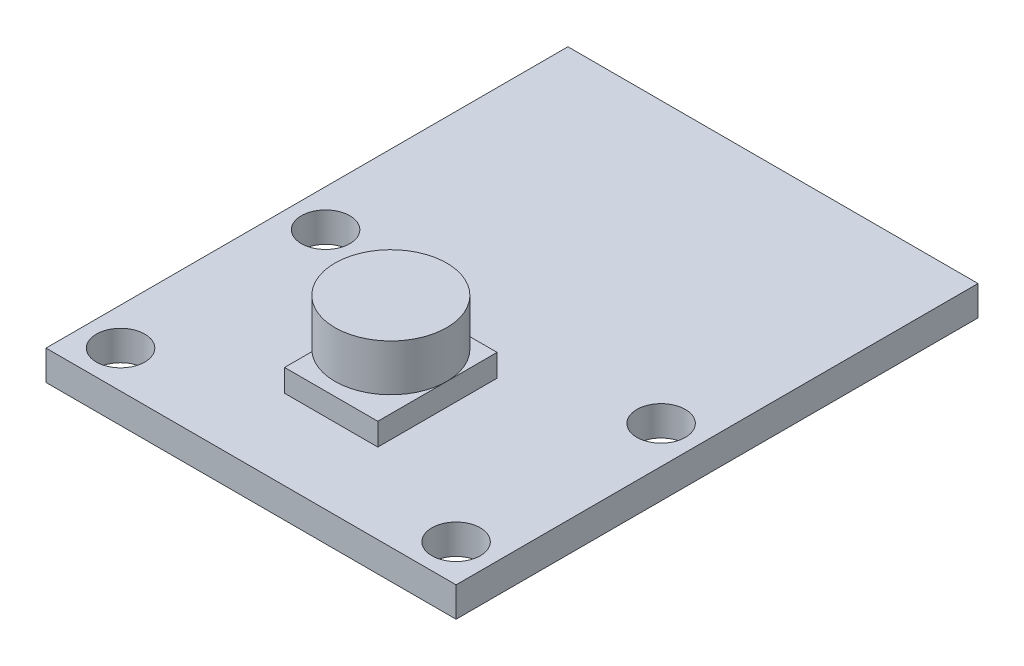
from build123d import *

# Parameters (mm, degrees)
ESQUISSE1_W        = 22
ESQUISSE1_H        = 28
ESQUISSE1_R        = 1.3
BOSS_EXTRU_1_DEPTH = 1.6
ESQUISSE2_W        = 5
ESQUISSE2_H        = 6.4
BOSS_EXTRU_2_DEPTH = 1.2
BOSS_EXTRU_3_START = 0.5
ESQUISSE3_R        = 3
BOSS_EXTRU_3_DEPTH = 2.5


with BuildPart() as part:
    # Esquisse1 → Boss.-Extru.1 (new body)
    with BuildSketch(Plane(origin=(0, 0, 0), x_dir=(1, 0, 0), z_dir=(0, 1, 0))):
        with Locations((0, 6.5)):
            Rectangle(ESQUISSE1_W, ESQUISSE1_H)
        with Locations(Location((-9, 5.5, 0), (0, 0, 270))):
            Circle(ESQUISSE1_R, mode=Mode.SUBTRACT)
        with Locations(Location((9, 5.5, 0), (0, 0, 270))):
            Circle(ESQUISSE1_R, mode=Mode.SUBTRACT)
        with Locations(Location((9, -5.5, 0), (0, 0, 270))):
            Circle(ESQUISSE1_R, mode=Mode.SUBTRACT)
        with Locations(Location((-9, -5.5, 0), (0, 0, 270))):
            Circle(ESQUISSE1_R, mode=Mode.SUBTRACT)
    extrude(amount=BOSS_EXTRU_1_DEPTH)

    # Esquisse2 → Boss.-Extru.2 (add)
    with BuildSketch(Plane(origin=(0, 1.6, 0), x_dir=(1, 0, 0), z_dir=(0, 1, 0))):
        Rectangle(ESQUISSE2_W, ESQUISSE2_H)
    extrude(amount=BOSS_EXTRU_2_DEPTH)


with BuildPart() as body_2:
    # Esquisse3 → Boss.-Extru.3 (new body)
    with BuildSketch(Plane(origin=(0, 2.8, 0), x_dir=(1, 0, 0), z_dir=(0, 1, 0)).offset(BOSS_EXTRU_3_START)):
        with Locations(Location((0, 0, 0), (0, 0, 270))):
            Circle(ESQUISSE3_R)
    extrude(amount=BOSS_EXTRU_3_DEPTH)


solid = Compound([part.part, body_2.part])
